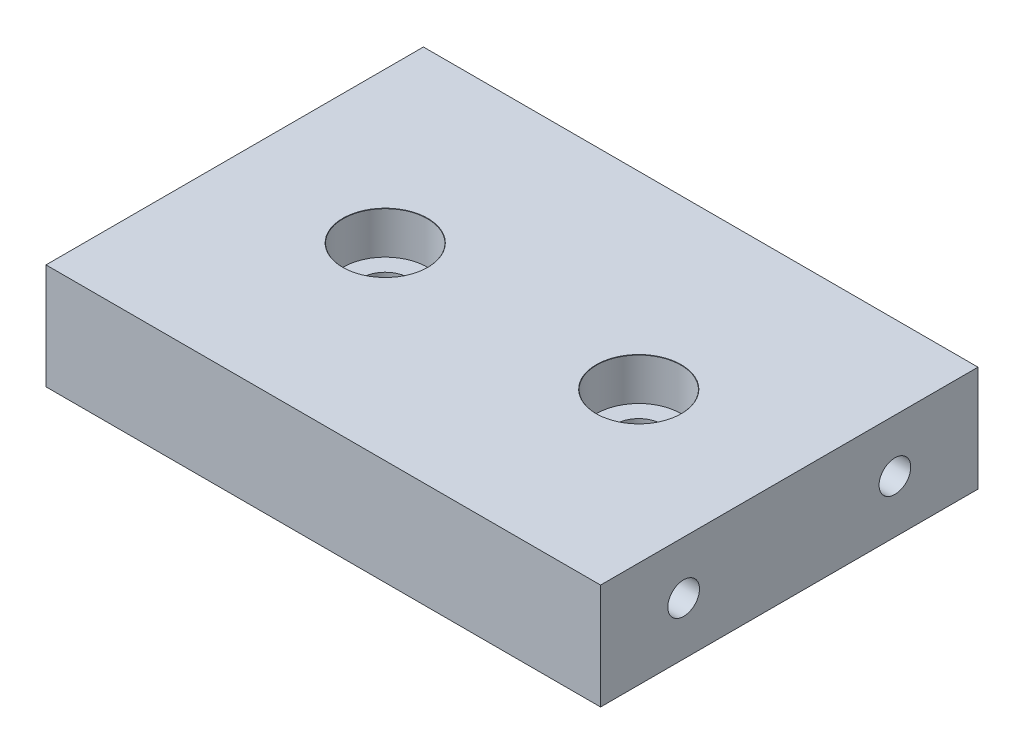
from build123d import *

# Parameters (mm, degrees)
SKETCH1_W                     = 52.5
SKETCH1_H                     = 35.73
BOSS_EXTRUDE1_DEPTH           = 10
SKETCH3_R                     = 1.5
CUT_EXTRUDE1_DEPTH            = 10
CBORE_FOR_M4_SHCS1_AT_2_COUNT = 2
CBORE_FOR_M4_SHCS1_AT_2_PITCH = 24


with BuildPart() as part:
    # Sketch1 → Boss-Extrude1 (new body)
    with BuildSketch(Plane(origin=(0, 0, 0), x_dir=(1, 0, 0), z_dir=(0, 1, 0))):
        with Locations((26.25, 17.865)):
            Rectangle(SKETCH1_W, SKETCH1_H)
    extrude(amount=BOSS_EXTRUDE1_DEPTH)

    # Sketch3 → Cut-Extrude1 (cut)
    with BuildSketch(Plane.ZY):
        with Locations((-27.865, 5)):
            Circle(SKETCH3_R)
        with Locations((-7.865, 5)):
            Circle(SKETCH3_R)
    cut_extrude1 = extrude(amount=-CUT_EXTRUDE1_DEPTH, mode=Mode.SUBTRACT)

    # Mirror1: Cut-Extrude1 across plane
    add(cut_extrude1.mirror(Plane(origin=(26.25, 0, 0), x_dir=(0, 0, 1), z_dir=(1, 0, 0))), mode=Mode.SUBTRACT)

    # Sketch6 → CBORE for M4 SHCS1 (revolve, cut)
    with BuildSketch(Plane(origin=(38.25, 10, -17.865), x_dir=(0, 0, 1), z_dir=(1, 0, 0))):
        Polygon((0, 0), (0, 10), (2.25, 10), (2.25, 4), (4, 4), (4, 0.025), (4.025, 0), align=None)
    cbore_for_m4_shcs1 = revolve(axis=Axis((38.25, 16.35, -17.865), (0, -1, 0)), mode=Mode.SUBTRACT)

    # CBORE for M4 SHCS1 at 2: CBORE for M4 SHCS1 ×2
    with Locations(*[(-i * CBORE_FOR_M4_SHCS1_AT_2_PITCH, 0, 0) for i in range(1, CBORE_FOR_M4_SHCS1_AT_2_COUNT)]):
        add(cbore_for_m4_shcs1, mode=Mode.SUBTRACT)


solid = part.part
